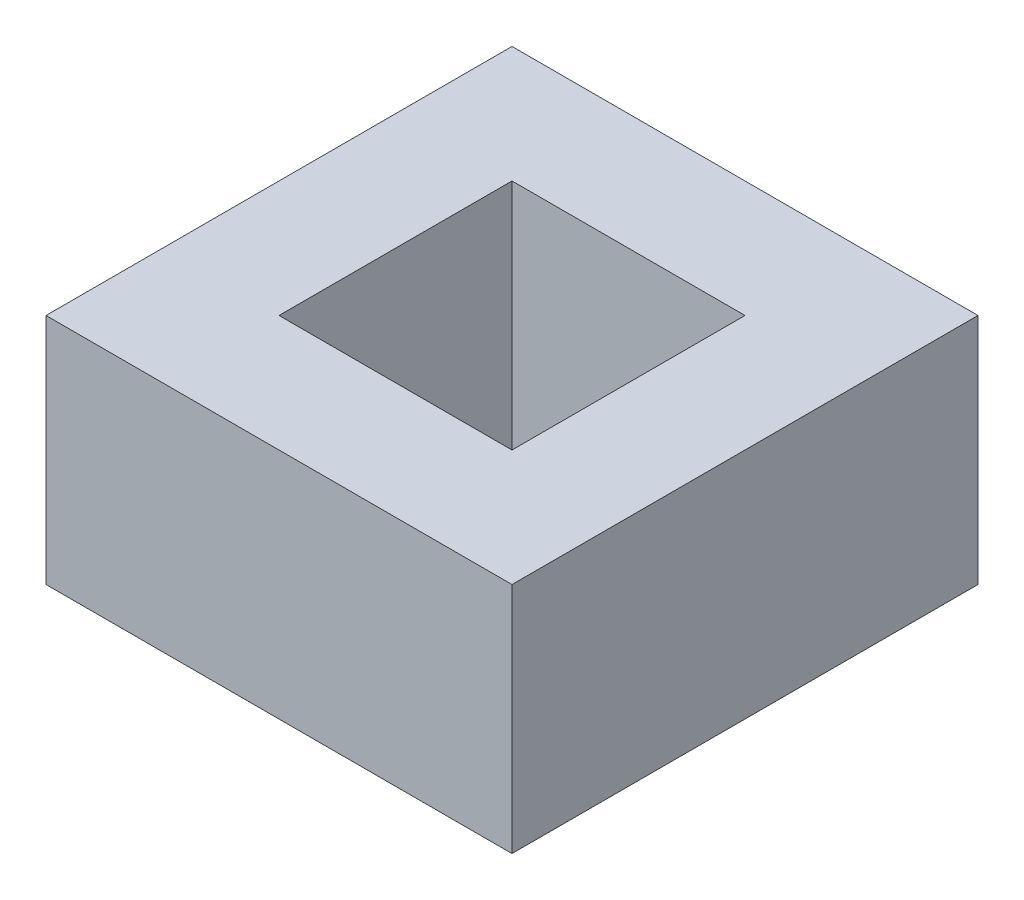
from build123d import *

# Parameters (mm, degrees)
SKETCH1_W           = 40
SKETCH1_H           = 40
SKETCH1_W_2         = 20
SKETCH1_H_2         = 20
BOSS_EXTRUDE1_DEPTH = 20


with BuildPart() as part:
    # Sketch1 → Boss-Extrude1 (new body)
    with BuildSketch(Plane(origin=(0, 0, 0), x_dir=(1, 0, 0), z_dir=(0, 1, 0))):
        with Locations((-20, -20)):
            Rectangle(SKETCH1_W, SKETCH1_H)
        with Locations((-20, -20)):
            Rectangle(SKETCH1_W_2, SKETCH1_H_2, mode=Mode.SUBTRACT)
    extrude(amount=BOSS_EXTRUDE1_DEPTH)


solid = part.part
